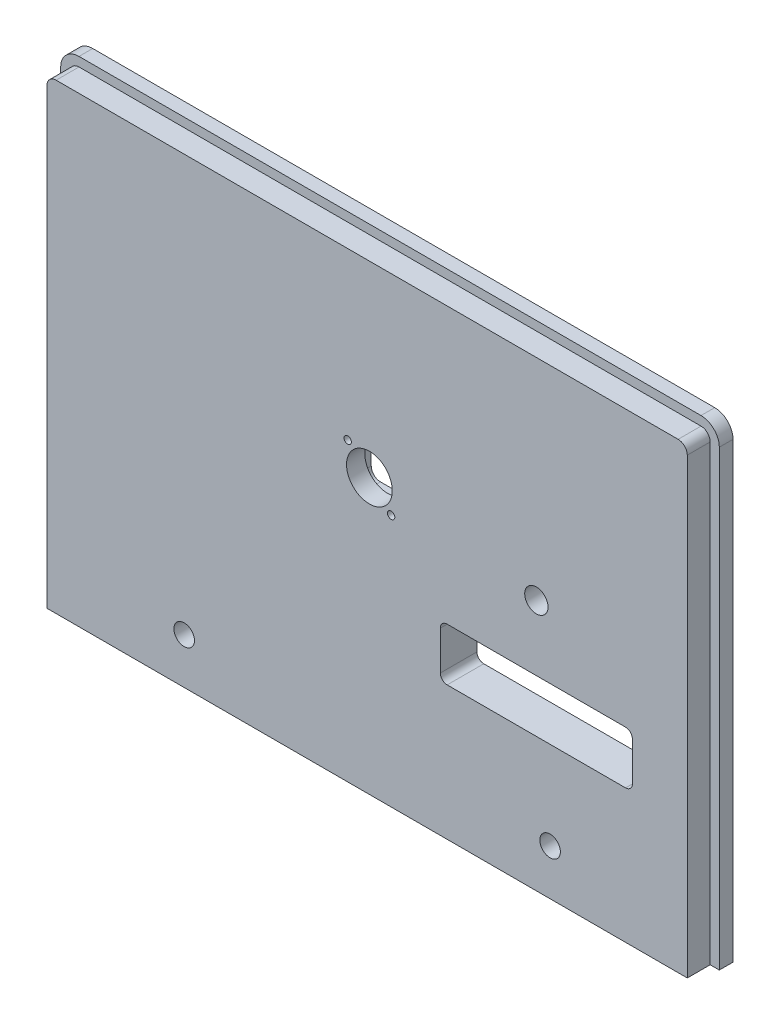
from build123d import *

# Parameters (mm, degrees)
BOSS_EXTRUDE1_DEPTH                                 = 8
BOSS_EXTRUDE2_DEPTH                                 = 3
CUT_EXTRUDE1_START                                  = -4
SKETCH13_W                                          = 15.2
SKETCH13_H                                          = 15.2
CUT_EXTRUDE1_DEPTH                                  = 4
FILLET1_R                                           = 2
SKETCH14_R                                          = 5
CUT_EXTRUDE4_DEPTH                                  = 126.924580603
M2_TAPPED_HOLE1_D                                   = 1.6
CUT_EXTRUDE5_DEPTH                                  = 126.924580603
M2_5_TAPPED_HOLE1_D                                 = 2.05
M2_5_TAPPED_HOLE1_DEPTH                             = 7.25
M2_5_TAPPED_HOLE1_TIP                               = 0.615882135
CSK_FOR_M5_COUNTERSUNK_FLAT_HEAD_SCREW1_D           = 5.1
CSK_FOR_M5_COUNTERSUNK_FLAT_HEAD_SCREW1_CSINK_D     = 10.4
CSK_FOR_M5_COUNTERSUNK_FLAT_HEAD_SCREW1_CSINK_ANGLE = 90


with BuildPart() as part:
    # Sketch3 → Boss-Extrude1 (new body)
    with BuildSketch(Plane(origin=(0, 0, 0), x_dir=(-1, 0, 0), z_dir=(0, 0, -1))):
        with BuildLine():
            Line((-70, 0), (70, 0))
            Line((70, 0), (70, 99))
            ThreePointArc((70, 99), (69.414213562, 100.414213562), (68, 101))
            Line((68, 101), (-68, 101))
            ThreePointArc((-68, 101), (-69.414213562, 100.414213562), (-70, 99))
            Line((-70, 99), (-70, 0))
        make_face()
    extrude(amount=BOSS_EXTRUDE1_DEPTH)

    # Sketch4 → Boss-Extrude2 (add)
    with BuildSketch(Plane(origin=(0, 0, -8), x_dir=(-1, 0, 0), z_dir=(0, 0, -1))):
        with BuildLine():
            Line((-72, 0), (72, 0))
            Line((72, 0), (72, 99))
            ThreePointArc((72, 99), (70.828427125, 101.828427125), (68, 103))
            Line((68, 103), (-68, 103))
            ThreePointArc((-68, 103), (-70.828427125, 101.828427125), (-72, 99))
            Line((-72, 99), (-72, 0))
        make_face()
    extrude(amount=-BOSS_EXTRUDE2_DEPTH)

    # Sketch5 → CSK for M4 Countersunk Flat Head Screw1 (revolve, cut)
    with BuildSketch(Plane(origin=(40, 10, -8), x_dir=(0, 1, 0), z_dir=(1, 0, 0))):
        Polygon((0, 0), (0, 8), (2.25, 8), (2.25, 3.45), (4.7, 1), (4.7, 0), align=None)
    csk_for_m4_countersunk_flat_head_screw1 = revolve(axis=Axis((40, 10, -14.35), (0, 0, 1)), mode=Mode.SUBTRACT)

    # Mirror1: CSK for M4 Countersunk Flat Head Screw1 across plane
    add(csk_for_m4_countersunk_flat_head_screw1.mirror(Plane(origin=(0, 0, 0), x_dir=(0, 0, 1), z_dir=(1, 0, 0))), mode=Mode.SUBTRACT)

    # Sketch13 → Cut-Extrude1 (cut)
    with BuildSketch(Plane(origin=(0, 0, -8), x_dir=(-1, 0, 0), z_dir=(0, 0, -1)).offset(CUT_EXTRUDE1_START)):
        with Locations((-0.5, 60)):
            Rectangle(SKETCH13_W, SKETCH13_H)
    extrude(amount=CUT_EXTRUDE1_DEPTH, mode=Mode.SUBTRACT)

    # Fillet1
    fillet1_edges = [part.edges().sort_by_distance(p)[0] for p in [
        (8.1, 67.6, -6),
        (8.1, 52.4, -6),
        (-7.1, 52.4, -6),
        (-7.1, 67.6, -6),
    ]]
    fillet(fillet1_edges, radius=FILLET1_R)

    # Sketch14 → Cut-Extrude4 (cut, through all)
    with BuildSketch(Plane(origin=(0, 0, -8), x_dir=(-1, 0, 0), z_dir=(0, 0, -1))):
        with Locations((-0.5, 60)):
            Circle(SKETCH14_R)
    extrude(amount=-CUT_EXTRUDE4_DEPTH, mode=Mode.SUBTRACT)

    # M2 Tapped Hole1 (through all)
    with Locations(Plane(origin=(0, 0, -4), x_dir=(-1, 0, 0), z_dir=(0, 0, -1))):
        with Locations((4.25, 64.75), (-5.25, 55.25)):
            Hole(M2_TAPPED_HOLE1_D / 2)

    # DB conn slot → Cut-Extrude5 (cut, through all)
    with BuildSketch(Plane(origin=(0, 0, -8), x_dir=(-1, 0, 0), z_dir=(0, 0, -1))):
        with BuildLine():
            Line((-56.5, 29.25), (-17.5, 29.25))
            ThreePointArc((-17.5, 29.25), (-16.439339828, 29.689339828), (-16, 30.75))
            Line((-16, 30.75), (-16, 39.25))
            ThreePointArc((-16, 39.25), (-16.439339828, 40.310660172), (-17.5, 40.75))
            Line((-17.5, 40.75), (-56.5, 40.75))
            ThreePointArc((-56.5, 40.75), (-57.560660172, 40.310660172), (-58, 39.25))
            Line((-58, 39.25), (-58, 30.75))
            ThreePointArc((-58, 30.75), (-57.560660172, 29.689339828), (-56.5, 29.25))
        make_face()
    extrude(amount=-CUT_EXTRUDE5_DEPTH, mode=Mode.SUBTRACT)

    # M2.5 Tapped Hole1
    with Locations(Plane(origin=(0, 0, -8), x_dir=(-1, 0, 0), z_dir=(0, 0, -1))):
        with Locations((-60.75, 35), (-13.25, 35)):
            Hole(M2_5_TAPPED_HOLE1_D / 2, depth=M2_5_TAPPED_HOLE1_DEPTH)
            with Locations((0, 0, -(M2_5_TAPPED_HOLE1_DEPTH + M2_5_TAPPED_HOLE1_TIP / 2))):  # 118° drill point
                Cone(0, M2_5_TAPPED_HOLE1_D / 2, M2_5_TAPPED_HOLE1_TIP, mode=Mode.SUBTRACT)

    # CSK for M5 Countersunk Flat Head Screw1 (through all)
    with Locations(Plane(origin=(0, 0, -8), x_dir=(-1, 0, 0), z_dir=(0, 0, -1))):
        with Locations((-37, 55)):
            CounterSinkHole(CSK_FOR_M5_COUNTERSUNK_FLAT_HEAD_SCREW1_D / 2, CSK_FOR_M5_COUNTERSUNK_FLAT_HEAD_SCREW1_CSINK_D / 2, counter_sink_angle=CSK_FOR_M5_COUNTERSUNK_FLAT_HEAD_SCREW1_CSINK_ANGLE)


solid = part.part
